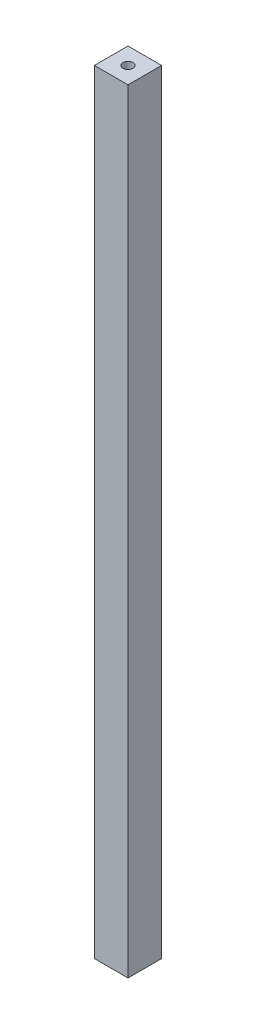
from build123d import *

# Parameters (mm, degrees)
SKETCH_1_W             = 20
SKETCH_1_H             = 460
EXTRUDE_1_DEPTH        = 20
CUT_EXTRUDE_1_DEPTH    = 400
HOLE_WIZARD_M8_1_D     = 6.8
HOLE_WIZARD_M8_1_DEPTH = 19.75
HOLE_WIZARD_M8_1_TIP   = 2.042926105


with BuildPart() as part:
    # 草图1 → 凸台-拉伸1 (new body)
    with BuildSketch(Plane.XY):
        with Locations((10, 230)):
            Rectangle(SKETCH_1_W, SKETCH_1_H)
    extrude(amount=EXTRUDE_1_DEPTH)

    # 草图2 → 切除-拉伸1 (cut)
    with BuildSketch(Plane(origin=(0, 460, 0), x_dir=(1, 0, 0), z_dir=(0, 1, 0))):
        with BuildLine():
            ThreePointArc((13, -10), (10, -7), (7, -10))
            Line((7, -10), (13, -10))
        make_face()
        with BuildLine():
            Line((13, -10), (7, -10))
            ThreePointArc((7, -10), (10, -13), (13, -10))
        make_face()
    extrude(amount=-CUT_EXTRUDE_1_DEPTH, mode=Mode.SUBTRACT)

    # M8 螺纹孔1
    with Locations(Plane(origin=(0, 0, 0), x_dir=(-1, 0, 0), z_dir=(0, -1, 0))):
        with Locations((-10, -10)):
            Hole(HOLE_WIZARD_M8_1_D / 2, depth=HOLE_WIZARD_M8_1_DEPTH)
            with Locations((0, 0, -(HOLE_WIZARD_M8_1_DEPTH + HOLE_WIZARD_M8_1_TIP / 2))):  # 118° drill point
                Cone(0, HOLE_WIZARD_M8_1_D / 2, HOLE_WIZARD_M8_1_TIP, mode=Mode.SUBTRACT)


solid = part.part
